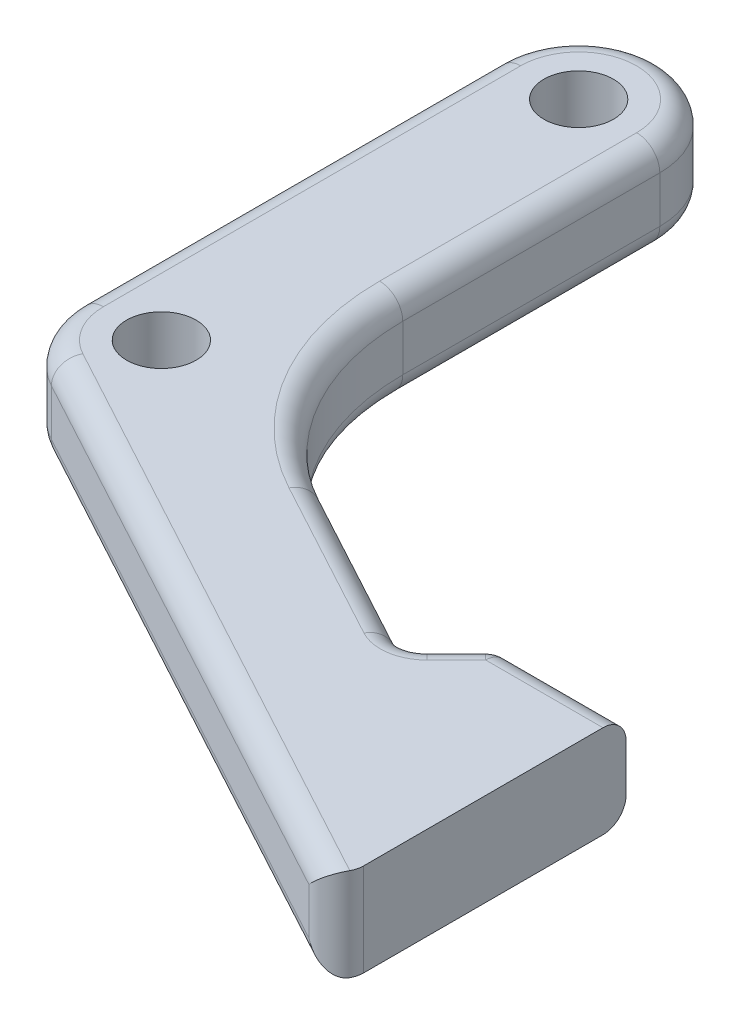
from build123d import *

# Parameters (mm, degrees)
SKETCH1_R           = 1.5
BOSS_EXTRUDE1_DEPTH = 4
FILLET1_R           = 1


with BuildPart() as part:
    # Sketch1 → Boss-Extrude1 (new body)
    with BuildSketch(Plane(origin=(0, 0, 0), x_dir=(1, 0, 0), z_dir=(0, 1, 0))):
        with BuildLine():
            Line((3.499999994, 18.000210437), (3.500666698, 6.911553125))
            ThreePointArc((3.500666698, 6.911553125), (4.91134936, 1.791253282), (8.744863366, -1.884568587))
            Line((8.744863366, -1.884568587), (15.782241735, -5.689211238))
            ThreePointArc((15.782241735, -5.689211238), (16.402202946, -5.79906113), (16.964928847, -5.516645723))
            Line((16.964928847, -5.516645723), (18.23595273, -4.24562184))
            ThreePointArc((18.23595273, -4.24562184), (18.560376079, -4.028849089), (18.943059511, -3.952728622))
            Line((18.943059511, -3.952728622), (24, -3.952728622))
            Line((24, -3.952728622), (24, -16.952728622))
            Line((24, -16.952728622), (-1.664016467, -3.077901019))
            ThreePointArc((-1.664016467, -3.077901019), (-3.005385337, -1.791670857), (-3.498917759, -6.5e-08))
            Line((-3.498917759, -6.5e-08), (-3.499999994, 17.999789563))
            ThreePointArc((-3.499999994, 17.999789563), (-0.000210437, 21.499999994), (3.499999994, 18.000210437))
        make_face()
        with Locations(Location((0, 0, 0), (0, 0, 270))):
            Circle(SKETCH1_R, mode=Mode.SUBTRACT)
        with Locations(Location((0, 18, 0), (0, 0, 270))):
            Circle(SKETCH1_R, mode=Mode.SUBTRACT)
    extrude(amount=BOSS_EXTRUDE1_DEPTH)

    # Fillet1
    fillet1_edges = [part.edges().sort_by_distance(p)[0] for p in [
        (-3.005385337, 4, 1.791670857),
        (3.500333346, 0, -12.455881781),
        (4.91134936, 0, -1.791253282),
        (12.26355255, 0, 3.786889912),
        (16.402202946, 0, 5.79906113),
        (17.600440788, 0, 4.881133782),
        (18.560376079, 0, 4.028849089),
        (11.167991766, 4, 10.01531482),
        (21.471529755, 0, 3.952728622),
        (11.167991766, 0, 10.01531482),
        (-3.005385337, 0, 1.791670857),
        (-3.499458876, 0, -8.999894749),
        (-0.000210437, 0, -21.499999994),
        (21.471529755, 4, 3.952728622),
        (24, 2, 16.952728622),
        (18.560376079, 4, 4.028849089),
        (17.600440788, 4, 4.881133782),
        (16.402202946, 4, 5.79906113),
        (12.26355255, 4, 3.786889912),
        (4.91134936, 4, -1.791253282),
        (3.500333346, 4, -12.455881781),
        (-0.000210437, 4, -21.499999994),
        (-3.499458876, 4, -8.999894749),
    ]]
    fillet(fillet1_edges, radius=FILLET1_R)


solid = part.part
